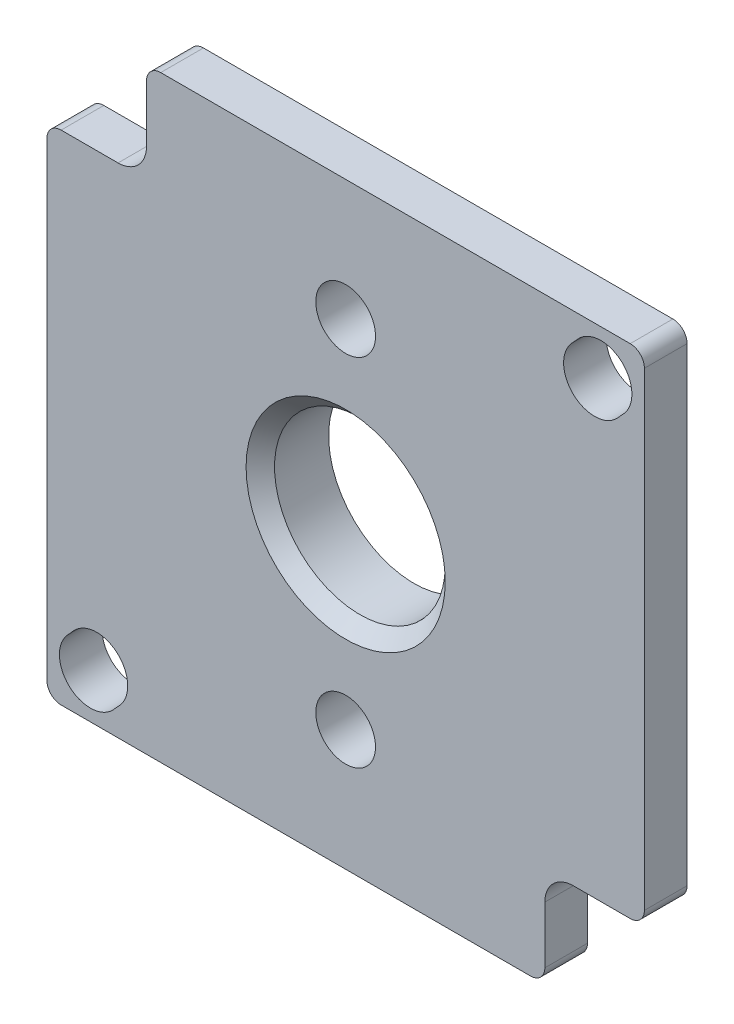
from build123d import *

# Parameters (mm, degrees)
SKETCH1_W                  = 42
SKETCH1_H                  = 42
BOSS_EXTRUDE1_DEPTH        = 3
SKETCH2_W                  = 7
SKETCH2_H                  = 7
CUT_EXTRUDE1_DEPTH         = 30.849623113
SKETCH3_W                  = 7
SKETCH3_H                  = 7
CUT_EXTRUDE2_DEPTH         = 30.849623113
CUT_EXTRUDE3_DEPTH         = 30.849623113
CUT_EXTRUDE4_DEPTH         = 30.849623113
BOSS_EXTRUDE2_DEPTH        = 1.8
CUT_EXTRUDE5_DEPTH         = 1.8
CUT_EXTRUDE6_DEPTH         = 1.8
CUT_EXTRUDE7_DEPTH         = 1.8
CUT_EXTRUDE8_DEPTH         = 1.8
CUT_EXTRUDE9_DEPTH         = 1.8
CUT_EXTRUDE10_DEPTH        = 1.8
F_4_2_4_2_DIAMETER_HOLE1_D = 4.2
F_12_0_12_DIAMETER_HOLE1_D = 12
CHAMFER1_SIZE              = 1
CHAMFER2_SIZE              = 0.5
FILLET1_R                  = 1
FILLET2_R                  = 2


with BuildPart() as part:
    # Sketch1 → Boss-Extrude1 (new body)
    with BuildSketch(Plane(origin=(0, 0, -1.5), x_dir=(-1, 0, 0), z_dir=(0, 0, -1))):
        Rectangle(SKETCH1_W, SKETCH1_H)
    extrude(amount=-BOSS_EXTRUDE1_DEPTH)

    # Sketch2 → Cut-Extrude1 (cut, through all)
    with BuildSketch(Plane.XY.offset(1.5)):
        with Locations((17.5, -17.5)):
            Rectangle(SKETCH2_W, SKETCH2_H)
    extrude(amount=-CUT_EXTRUDE1_DEPTH, mode=Mode.SUBTRACT)

    # Sketch3 → Cut-Extrude2 (cut, through all)
    with BuildSketch(Plane.XY.offset(1.5)):
        with Locations((-17.5, 17.5)):
            Rectangle(SKETCH3_W, SKETCH3_H)
    extrude(amount=-CUT_EXTRUDE2_DEPTH, mode=Mode.SUBTRACT)

    # Sketch4 → Cut-Extrude3 (cut, through all)
    with BuildSketch(Plane(origin=(0, 0, -1.5), x_dir=(-1, 0, 0), z_dir=(0, 0, -1))):
        with BuildLine():
            Line((-19.548087821, 16.508696573), (-19.107888427, 16.027894431))
            ThreePointArc((-19.107888427, 16.027894431), (-16.027894431, 15.892111573), (-15.892111573, 18.972105569))
            Line((-15.892111573, 18.972105569), (-16.332310968, 19.452907712))
            ThreePointArc((-16.332310968, 19.452907712), (-19.412304964, 19.588690569), (-19.548087821, 16.508696573))
        make_face()
    extrude(amount=-CUT_EXTRUDE3_DEPTH, mode=Mode.SUBTRACT)

    # Sketch5 → Cut-Extrude4 (cut, through all)
    with BuildSketch(Plane.XY.offset(1.5)):
        with BuildLine():
            Line((-16.332310968, -19.452907712), (-15.892111573, -18.972105569))
            ThreePointArc((-15.892111573, -18.972105569), (-16.027894431, -15.892111573), (-19.107888427, -16.027894431))
            Line((-19.107888427, -16.027894431), (-19.548087821, -16.508696573))
            ThreePointArc((-19.548087821, -16.508696573), (-19.412304964, -19.588690569), (-16.332310968, -19.452907712))
        make_face()
    extrude(amount=-CUT_EXTRUDE4_DEPTH, mode=Mode.SUBTRACT)

    # Sketch6 → Boss-Extrude2 (add)
    with BuildSketch(Plane(origin=(0, 0, -1.5), x_dir=(-1, 0, 0), z_dir=(0, 0, -1))):
        with BuildLine():
            ThreePointArc((5.054164776, -14.01661223), (4.091520809, -13.857772568), (3.722336121, -12.954657895))
            ThreePointArc((3.722336121, -12.954657895), (0, -8.75), (-3.722336121, -12.954657895))
            ThreePointArc((-3.722336121, -12.954657895), (-4.091520809, -13.857772568), (-5.054164776, -14.01661223))
            ThreePointArc((-5.054164776, -14.01661223), (-14.9, 0), (-5.054164776, 14.01661223))
            ThreePointArc((-5.054164776, 14.01661223), (-4.091520809, 13.857772568), (-3.722336121, 12.954657895))
            ThreePointArc((-3.722336121, 12.954657895), (0, 8.75), (3.722336121, 12.954657895))
            ThreePointArc((3.722336121, 12.954657895), (4.091520809, 13.857772568), (5.054164776, 14.01661223))
            ThreePointArc((5.054164776, 14.01661223), (14.9, 0), (5.054164776, -14.01661223))
        make_face()
    extrude(amount=BOSS_EXTRUDE2_DEPTH)

    # Sketch7 → Cut-Extrude5 (cut)
    with BuildSketch(Plane(origin=(0, 0, -3.3), x_dir=(-1, 0, 0), z_dir=(0, 0, -1))):
        with BuildLine():
            Line((12.180022738, -5.586326708), (7.185244801, -3.517421946))
            ThreePointArc((7.185244801, -3.517421946), (5.763132034, -5.548541174), (3.787411898, -7.046666667))
            ThreePointArc((3.787411898, -7.046666667), (3.269080183, -7.799376362), (3.579104244, -8.6591))
            ThreePointArc((3.579104244, -8.6591), (4.779623152, -10.327972715), (5.247243656, -12.3299))
            ThreePointArc((5.247243656, -12.3299), (9.343251505, -9.605396989), (12.180022738, -5.586326708))
        make_face()
    extrude(amount=-CUT_EXTRUDE5_DEPTH, mode=Mode.SUBTRACT)

    # Sketch8 → Cut-Extrude6 (cut)
    with BuildSketch(Plane(origin=(0, 0, -3.3), x_dir=(-1, 0, 0), z_dir=(0, 0, -1))):
        with BuildLine():
            Line((-12.180022738, 5.586326708), (-7.185244801, 3.517421946))
            ThreePointArc((-7.185244801, 3.517421946), (-5.763132034, 5.548541174), (-3.787411898, 7.046666667))
            ThreePointArc((-3.787411898, 7.046666667), (-3.269080183, 7.799376362), (-3.579104244, 8.6591))
            ThreePointArc((-3.579104244, 8.6591), (-4.779623152, 10.327972715), (-5.247243656, 12.3299))
            ThreePointArc((-5.247243656, 12.3299), (-9.343251505, 9.605396989), (-12.180022738, 5.586326708))
        make_face()
    extrude(amount=-CUT_EXTRUDE6_DEPTH, mode=Mode.SUBTRACT)

    # Sketch9 → Cut-Extrude7 (cut)
    with BuildSketch(Plane(origin=(0, 0, -3.3), x_dir=(-1, 0, 0), z_dir=(0, 0, -1))):
        with BuildLine():
            Line((-7.185244801, -3.517421946), (-12.180022738, -5.586326708))
            ThreePointArc((-12.180022738, -5.586326708), (-9.343251505, -9.605396989), (-5.247243656, -12.3299))
            ThreePointArc((-5.247243656, -12.3299), (-4.779623152, -10.327972715), (-3.579104244, -8.6591))
            ThreePointArc((-3.579104244, -8.6591), (-3.269080183, -7.799376362), (-3.787411898, -7.046666667))
            ThreePointArc((-3.787411898, -7.046666667), (-5.763132034, -5.548541174), (-7.185244801, -3.517421946))
        make_face()
    extrude(amount=-CUT_EXTRUDE7_DEPTH, mode=Mode.SUBTRACT)

    # Sketch10 → Cut-Extrude8 (cut)
    with BuildSketch(Plane(origin=(0, 0, -3.3), x_dir=(-1, 0, 0), z_dir=(0, 0, -1))):
        with BuildLine():
            Line((7.185244801, 3.517421946), (12.180022738, 5.586326708))
            ThreePointArc((12.180022738, 5.586326708), (9.343251505, 9.605396989), (5.247243656, 12.3299))
            ThreePointArc((5.247243656, 12.3299), (4.779623152, 10.327972715), (3.579104244, 8.6591))
            ThreePointArc((3.579104244, 8.6591), (3.269080183, 7.799376362), (3.787411898, 7.046666667))
            ThreePointArc((3.787411898, 7.046666667), (5.763132034, 5.548541174), (7.185244801, 3.517421946))
        make_face()
    extrude(amount=-CUT_EXTRUDE8_DEPTH, mode=Mode.SUBTRACT)

    # Sketch11 → Cut-Extrude9 (cut)
    with BuildSketch(Plane(origin=(0, 0, -3.3), x_dir=(-1, 0, 0), z_dir=(0, 0, -1))):
        with BuildLine():
            Line((12.562706171, 4.662447176), (7.567928234, 2.593542413))
            ThreePointArc((7.567928234, 2.593542413), (8, 0), (7.567928234, -2.593542413))
            Line((7.567928234, -2.593542413), (12.562706171, -4.662447176))
            ThreePointArc((12.562706171, -4.662447176), (13.4, 0), (12.562706171, 4.662447176))
        make_face()
    extrude(amount=-CUT_EXTRUDE9_DEPTH, mode=Mode.SUBTRACT)

    # Sketch12 → Cut-Extrude10 (cut)
    with BuildSketch(Plane(origin=(0, 0, -3.3), x_dir=(-1, 0, 0), z_dir=(0, 0, -1))):
        with BuildLine():
            Line((-12.562706171, -4.662447176), (-7.567928234, -2.593542413))
            ThreePointArc((-7.567928234, -2.593542413), (-8, 0), (-7.567928234, 2.593542413))
            Line((-7.567928234, 2.593542413), (-12.562706171, 4.662447176))
            ThreePointArc((-12.562706171, 4.662447176), (-13.4, 0), (-12.562706171, -4.662447176))
        make_face()
    extrude(amount=-CUT_EXTRUDE10_DEPTH, mode=Mode.SUBTRACT)

    # Ø4.2 (4.2) Diameter Hole1 (through all)
    with Locations(Plane(origin=(0, 0, -1.5), x_dir=(-1, 0, 0), z_dir=(0, 0, -1))):
        with Locations((0, -12.5), (0, 12.5)):
            Hole(F_4_2_4_2_DIAMETER_HOLE1_D / 2)

    # Ø12.0 (12) Diameter Hole1 (through all)
    with Locations(Plane.XY.offset(1.5)):
        with Locations((0, 0)):
            Hole(F_12_0_12_DIAMETER_HOLE1_D / 2)

    # Chamfer1
    chamfer1_edges = [part.edges().sort_by_distance(p)[0] for p in [
        (6, 0, 1.5),
    ]]
    chamfer(chamfer1_edges, length=CHAMFER1_SIZE)

    # Chamfer2
    chamfer2_edges = [part.edges().sort_by_distance(p)[0] for p in [
        (-14.9, 0, -3.3),
        (-4.091520809, 13.857772568, -3.3),
        (0, 8.75, -3.3),
        (4.091520809, 13.857772568, -3.3),
        (14.9, 0, -3.3),
        (4.091520809, -13.857772568, -3.3),
        (0, -8.75, -3.3),
        (-4.091520809, -13.857772568, -3.3),
    ]]
    chamfer(chamfer2_edges, length=CHAMFER2_SIZE)

    # Fillet1
    fillet1_edges = [part.edges().sort_by_distance(p)[0] for p in [
        (-7.185244801, -3.517421946, -2.4),
        (-12.180022738, -5.586326708, -2.4),
        (-5.247243656, -12.3299, -2.4),
        (7.185244801, 3.517421946, -2.4),
        (12.180022738, 5.586326708, -2.4),
        (5.247243656, 12.3299, -2.4),
        (5.247243656, -12.3299, -2.4),
        (12.180022738, -5.586326708, -2.4),
        (7.185244801, -3.517421946, -2.4),
        (-5.247243656, 12.3299, -2.4),
        (-12.180022738, 5.586326708, -2.4),
        (-7.185244801, 3.517421946, -2.4),
        (-12.562706171, 4.662447176, -2.4),
        (-12.562706171, -4.662447176, -2.4),
        (-7.567928234, -2.593542413, -2.4),
        (-7.567928234, 2.593542413, -2.4),
        (21, -14, 0),
        (12.562706171, -4.662447176, -2.4),
        (12.562706171, 4.662447176, -2.4),
        (7.567928234, 2.593542413, -2.4),
        (7.567928234, -2.593542413, -2.4),
        (14, -21, 0),
        (-21, 14, 0),
        (-14, 21, 0),
        (21, 21, 0),
        (-21, -21, 0),
    ]]
    fillet(fillet1_edges, radius=FILLET1_R)

    # Fillet2
    fillet2_edges = [part.edges().sort_by_distance(p)[0] for p in [
        (14, -14, 0),
        (-14, 14, 0),
    ]]
    fillet(fillet2_edges, radius=FILLET2_R)


solid = part.part
